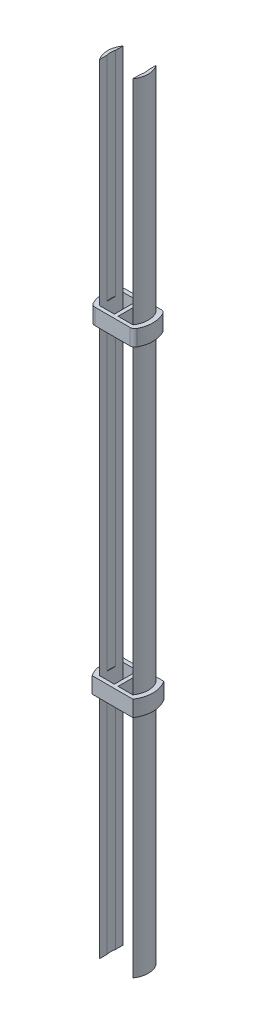
from build123d import *

# Parameters (mm, degrees)
SKETCH1_R               = 12.7
SKETCH1_R_2             = 10.75
BOSS_EXTRUDE1_DEPTH     = 510
CUT_EXTRUDE1_DEPTH      = 510
CUT_EXTRUDE2_DEPTH      = 16
CUT_EXTRUDE2_DEPTH_BACK = 19
SKETCH3_W               = 18.830602732
SKETCH3_H               = 12
SKETCH3_W_2             = 16.984597957
SKETCH5_W               = 9.256693762
SKETCH5_H               = 14.558945698
BOSS_EXTRUDE2_DEPTH     = 10
FILLET1_R               = 3


with BuildPart() as part:
    # Sketch1 → Boss-Extrude1 (new body)
    with BuildSketch(Plane(origin=(0, 0, 0), x_dir=(1, 0, 0), z_dir=(0, 1, 0))):
        with Locations(Location((0, 0, 0), (0, 0, 270))):
            Circle(SKETCH1_R)
        with Locations(Location((0, 0, 0), (0, 0, 270))):
            Circle(SKETCH1_R_2, mode=Mode.SUBTRACT)
    extrude(amount=BOSS_EXTRUDE1_DEPTH)

    # Sketch2 → Cut-Extrude1 (cut)
    with BuildSketch(Plane(origin=(0, 510, 0), x_dir=(1, 0, 0), z_dir=(0, 1, 0))):
        Polygon((10.406693762, 24.487366984), (10.406693762, -11.087366984), (10.406693762, -15.222442653), (-10.406693762, -15.222442653), (-10.406693762, -10.249436946), (-10.406693762, 23.649436946), align=None)
    extrude(amount=-CUT_EXTRUDE1_DEPTH, mode=Mode.SUBTRACT)


with BuildPart() as cut_extrude1_piece_1:
    # of the separate pieces the step leaves, piece 1, a body of its own (cut_extrude1_pieces)
    add(part.part.solids().sort_by_distance((10.406693762, 0, 7.279472849))[0])


with BuildPart() as cut_extrude1_piece_2:
    # of the separate pieces the step leaves, piece 2, a body of its own (cut_extrude1_pieces)
    add(part.part.solids().sort_by_distance((-10.406693762, 0, -7.279472849))[0])


with BuildPart() as cut_extrude2_tool:
    # Sketch3 → Cut-Extrude2 (new, two sides: drawn at the far end of the back side and taken through both)
    with BuildSketch(Plane(origin=(0, 0, 0), x_dir=(0, 0, -1), z_dir=(1, 0, 0)).offset(-CUT_EXTRUDE2_DEPTH_BACK)):
        with Locations((2.135828517, 6)):
            Rectangle(SKETCH3_W, SKETCH3_H)
        with Locations((1.21282613, 504)):
            Rectangle(SKETCH3_W_2, SKETCH3_H)
    extrude(amount=CUT_EXTRUDE2_DEPTH + CUT_EXTRUDE2_DEPTH_BACK)


with BuildPart() as cut_extrude1_piece_1_1:
    add(cut_extrude1_piece_1.part)

    # Cut-Extrude2: cut by cut_extrude2_tool
    add(cut_extrude2_tool.part, mode=Mode.SUBTRACT)



with BuildPart() as cut_extrude1_piece_2_1:
    add(cut_extrude1_piece_2.part)

    # Cut-Extrude2: cut by cut_extrude2_tool
    add(cut_extrude2_tool.part, mode=Mode.SUBTRACT)


with BuildPart() as cut_extrude1_piece_1_2:
    add(cut_extrude1_piece_1_1.part)

    add(cut_extrude1_piece_2_1.part)  # Boss-Extrude2 merges Cut-Extrude1 piece 2
    # Sketch5 → Boss-Extrude2 (add)
    with BuildSketch(Plane(origin=(0, 355, 0), x_dir=(1, 0, 0), z_dir=(0, 1, 0))):
        with BuildLine():
            Line((12.7, 9.720527151), (-12.7, 9.720527151))
            ThreePointArc((-12.7, 9.720527151), (-15.678586565, 0.070527151), (-12.7, -9.579472849))
            Line((-12.7, -9.579472849), (12.7, -9.579472849))
            ThreePointArc((12.7, -9.579472849), (15.616851042, 0.070527151), (12.7, 9.720527151))
        make_face()
        with Locations((-5.778346881, 0)):
            Rectangle(SKETCH5_W, SKETCH5_H, mode=Mode.SUBTRACT)
        with Locations((5.778346881, 0)):
            Rectangle(SKETCH5_W, SKETCH5_H, mode=Mode.SUBTRACT)
    boss_extrude2 = extrude(amount=BOSS_EXTRUDE2_DEPTH)

    # Fillet1
    fillet1_edges = [cut_extrude1_piece_1_2.edges().sort_by_distance(p)[0] for p in [
        (-12.7, 360, -9.720527151),
        (-12.7, 360, 9.579472849),
        (12.7, 360, 9.579472849),
        (12.7, 360, -9.720527151),
    ]]
    fillet(fillet1_edges, radius=FILLET1_R)

    # Mirror1: Boss-Extrude2 across plane
    add(boss_extrude2.mirror(Plane.ZX.offset(260)))


solid = cut_extrude1_piece_1_2.part
